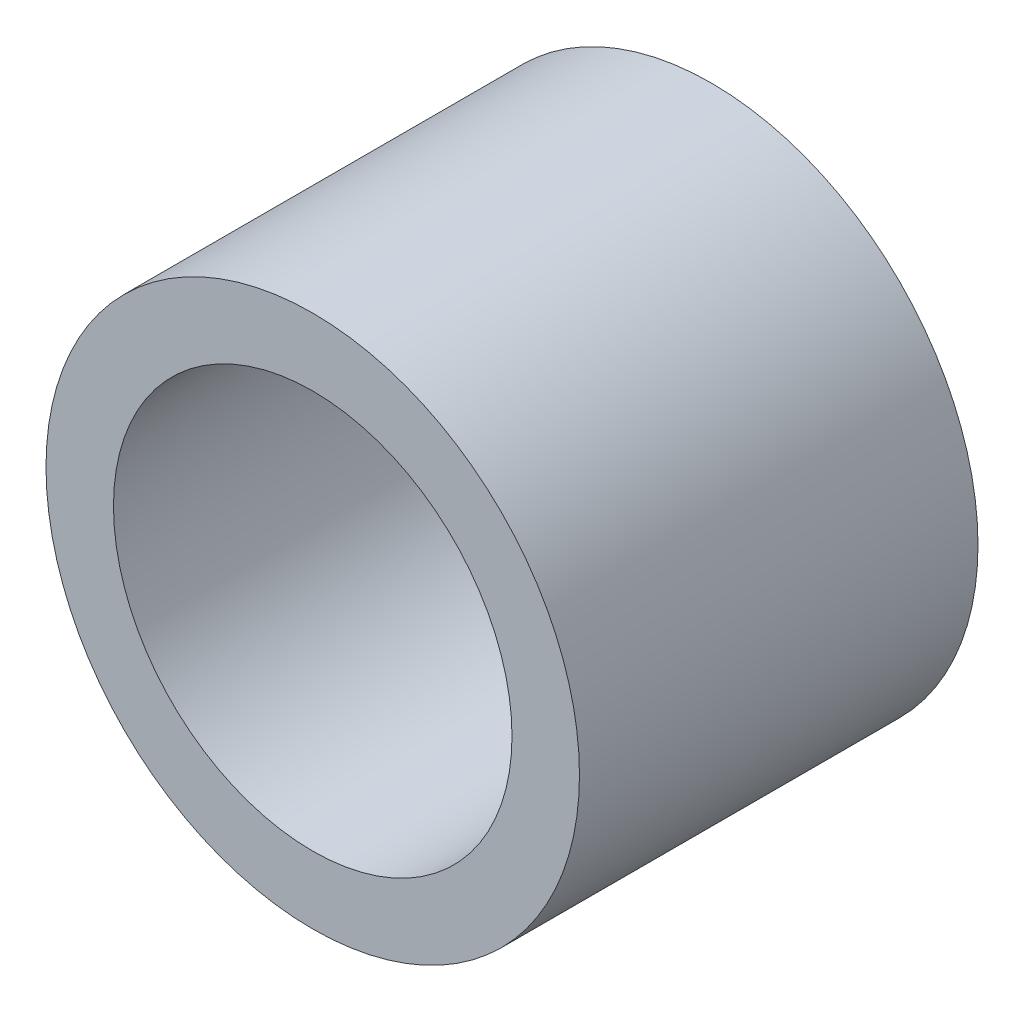
from build123d import *

# Parameters (mm, degrees)
SKETCH1_R           = 8.5
SKETCH1_R_2         = 6.35
BOSS_EXTRUDE1_DEPTH = 12.7


with BuildPart() as part:
    # Sketch1 → Boss-Extrude1 (new body)
    with BuildSketch(Plane.XY):
        Circle(SKETCH1_R)
        Circle(SKETCH1_R_2, mode=Mode.SUBTRACT)
    extrude(amount=BOSS_EXTRUDE1_DEPTH)


solid = part.part
